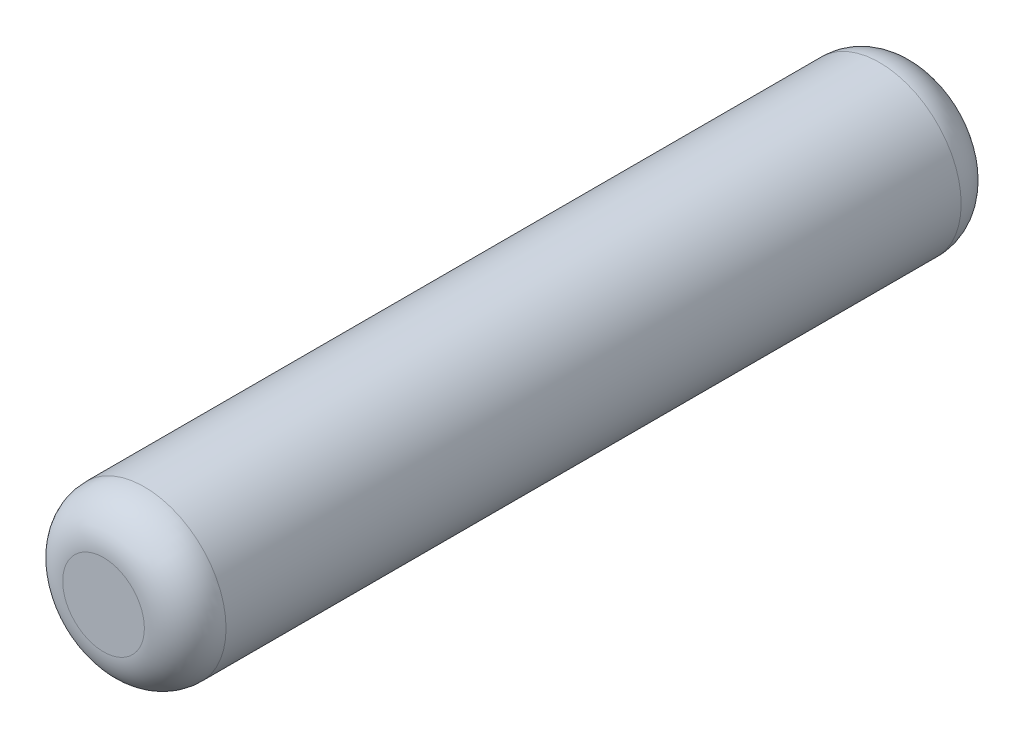
from build123d import *

# Parameters (mm, degrees)
SKETCH_1_R      = 1
EXTRUDE_1_DEPTH = 10
FILLET_1_R      = 0.5


with BuildPart() as part:
    # 草图1 → 凸台-拉伸1 (new body)
    with BuildSketch(Plane.XY):
        Circle(SKETCH_1_R)
    extrude(amount=EXTRUDE_1_DEPTH)

    # 圆角1
    fillet_1_edges = [part.edges().sort_by_distance(p)[0] for p in [
        (-1, 0, 0),
        (-1, 0, 10),
    ]]
    fillet(fillet_1_edges, radius=FILLET_1_R)


solid = part.part
